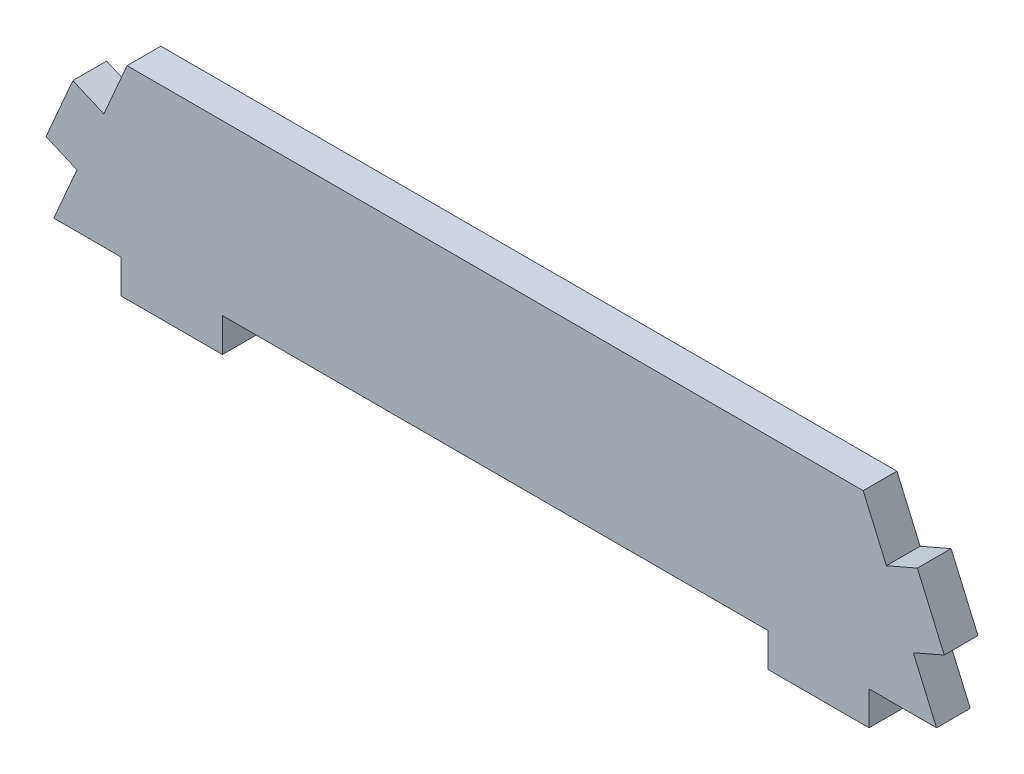
from build123d import *

# Parameters (mm, degrees)
BOSS_EXTRUDE1_DEPTH = 5


with BuildPart() as part:
    # Sketch1 → Boss-Extrude1 (new body)
    with BuildSketch(Plane.XY):
        Polygon((0, 0), (40.395, 0), (40.395, -5), (55.395, -5), (55.395, 0), (65.395, 0), (61.954765166, 7.914471805), (66.540293361, 9.907693111), (62.55385075, 19.078749501), (57.968322555, 17.085528195), (54.528087721, 25), (0, 25), align=None)
    boss_extrude1 = extrude(amount=BOSS_EXTRUDE1_DEPTH)

    # Mirror1: Boss-Extrude1 across plane
    add(boss_extrude1.mirror(Plane(origin=(0, 0, 5), x_dir=(0, 0, 1), z_dir=(1, 0, 0))))


solid = part.part
